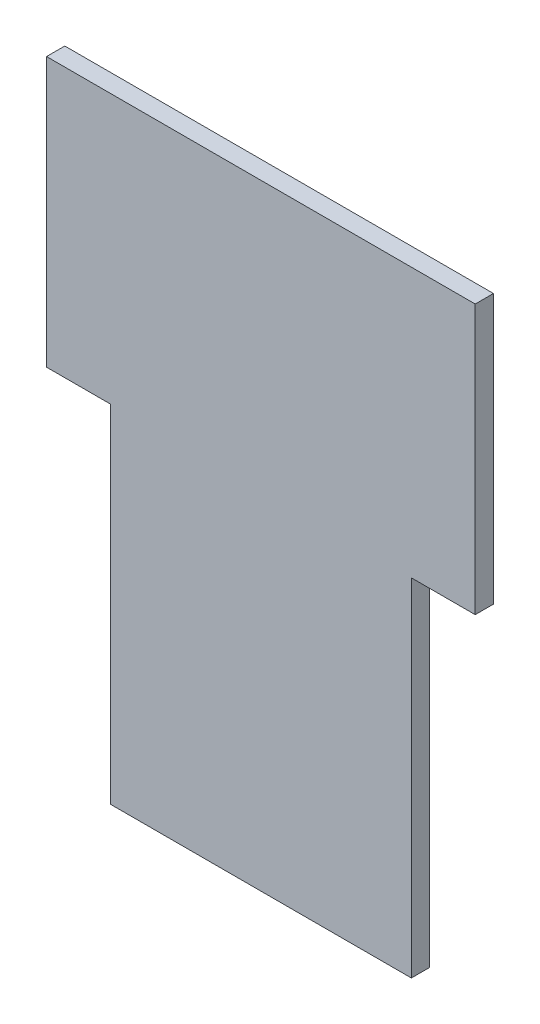
from build123d import *

# Parameters (mm, degrees)
BOSS_EXTRUDE1_DEPTH = 20


with BuildPart() as part:
    # Sketch2 → Boss-Extrude1 (new body)
    with BuildSketch(Plane.XY):
        Polygon((-235, 310.632183908), (235, 310.632183908), (235, 15.632183908), (165, 15.632183908), (165, -364.367816092), (-165, -364.367816092), (-165, 15.632183908), (-235, 15.632183908), align=None)
    extrude(amount=BOSS_EXTRUDE1_DEPTH)


solid = part.part
